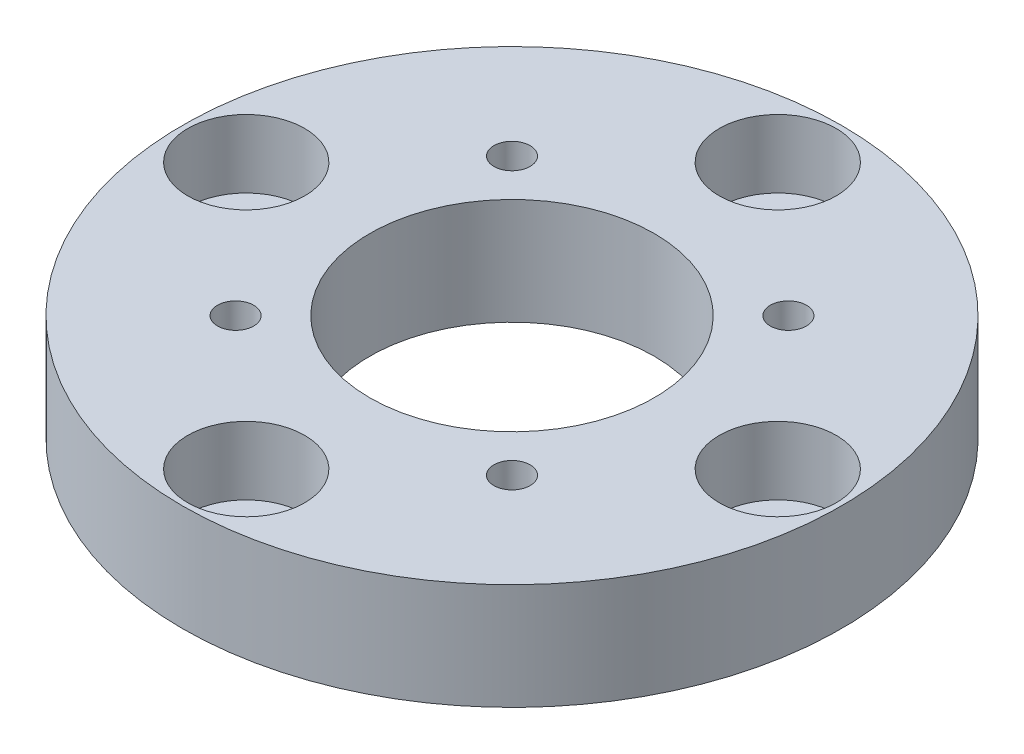
from build123d import *

# Parameters (mm, degrees)
SKETCH1_R                                           = 31
SKETCH1_R_2                                         = 13.384776311
BOSS_EXTRUDE1_DEPTH                                 = 10
CBORE_FOR_M6_HEX_SOCKET_HEAD_CAP_SCREW1_D           = 6.6
CBORE_FOR_M6_HEX_SOCKET_HEAD_CAP_SCREW1_CBORE_D     = 11
CBORE_FOR_M6_HEX_SOCKET_HEAD_CAP_SCREW1_CBORE_DEPTH = 6.4
M3_CLEARANCE_HOLE1_D                                = 3.4
CIRPATTERN1_COUNT                                   = 4


with BuildPart() as part:
    # Sketch1 → Boss-Extrude1 (new body)
    with BuildSketch(Plane(origin=(0, 0, 0), x_dir=(1, 0, 0), z_dir=(0, 1, 0))):
        with Locations(Location((0, 0, 0), (0, 0, 270))):
            Circle(SKETCH1_R)
        with Locations(Location((0, 0, 0), (0, 0, 270))):
            Circle(SKETCH1_R_2, mode=Mode.SUBTRACT)
    extrude(amount=BOSS_EXTRUDE1_DEPTH)

    # CBORE for M6 Hex Socket Head Cap Screw1 (through all)
    with Locations(Plane(origin=(0, 10, 0), x_dir=(1, 0, 0), z_dir=(0, 1, 0))):
        with Locations((0, 25)):
            cbore_for_m6_hex_socket_head_cap_screw1 = CounterBoreHole(CBORE_FOR_M6_HEX_SOCKET_HEAD_CAP_SCREW1_D / 2, CBORE_FOR_M6_HEX_SOCKET_HEAD_CAP_SCREW1_CBORE_D / 2, CBORE_FOR_M6_HEX_SOCKET_HEAD_CAP_SCREW1_CBORE_DEPTH)

    # M3 Clearance Hole1 (through all)
    with Locations(Plane(origin=(0, 10, 0), x_dir=(1, 0, 0), z_dir=(0, 1, 0))):
        with Locations((-13, 13)):
            m3_clearance_hole1 = Hole(M3_CLEARANCE_HOLE1_D / 2)

    # CirPattern1: CBORE for M6 Hex Socket Head Cap Screw1, M3 Clearance Hole1 ×4 about axis
    cirpattern1_axis = Axis((0, 0, 0), (0, 1, 0))
    add([cbore_for_m6_hex_socket_head_cap_screw1.rotate(cirpattern1_axis, i * 360 / CIRPATTERN1_COUNT) for i in range(1, CIRPATTERN1_COUNT)], mode=Mode.SUBTRACT)
    add([m3_clearance_hole1.rotate(cirpattern1_axis, i * 360 / CIRPATTERN1_COUNT) for i in range(1, CIRPATTERN1_COUNT)], mode=Mode.SUBTRACT)


solid = part.part
